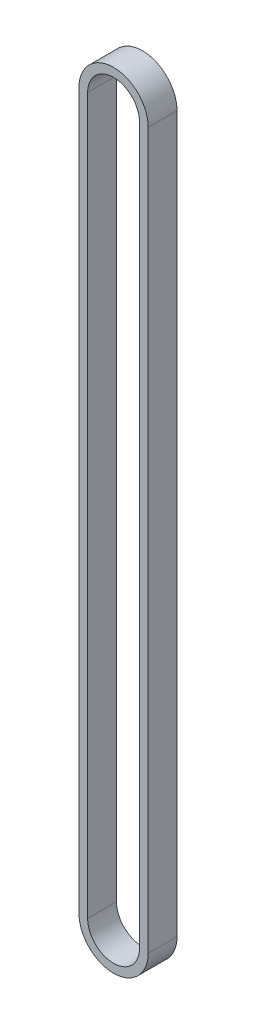
from build123d import *

# Parameters (mm, degrees)
EXTRUDE_1_DEPTH = 10


with BuildPart() as part:
    # 草图1 → 凸台-拉伸1 (new body)
    with BuildSketch(Plane.XY):
        with BuildLine():
            ThreePointArc((-12, 248), (-11.22497216, 243.757359313), (-9, 240.062746067))
            Line((-9, 240.062746067), (-9, 248))
            ThreePointArc((-9, 248), (0, 257), (9, 248))
            Line((9, 248), (9, 240.062746067))
            ThreePointArc((9, 240.062746067), (11.22497216, 243.757359313), (12, 248))
            ThreePointArc((12, 248), (0, 260), (-12, 248))
        make_face()
        with BuildLine():
            ThreePointArc((-12, 0), (-11.22497216, 4.242640687), (-9, 7.937253933))
            Line((-9, 7.937253933), (-9, 240.062746067))
            ThreePointArc((-9, 240.062746067), (-11.22497216, 243.757359313), (-12, 248))
            Line((-12, 248), (-12, 0))
        make_face()
        with BuildLine():
            Line((9, 240.062746067), (9, 7.937253933))
            ThreePointArc((9, 7.937253933), (11.22497216, 4.242640687), (12, 0))
            Line((12, 0), (12, 248))
            ThreePointArc((12, 248), (11.22497216, 243.757359313), (9, 240.062746067))
        make_face()
        with BuildLine():
            Line((9, 7.937253933), (9, 0))
            ThreePointArc((9, 0), (0, -9), (-9, 0))
            Line((-9, 0), (-9, 7.937253933))
            ThreePointArc((-9, 7.937253933), (-11.22497216, 4.242640687), (-12, 0))
            ThreePointArc((-12, 0), (0, -12), (12, 0))
            ThreePointArc((12, 0), (11.22497216, 4.242640687), (9, 7.937253933))
        make_face()
    extrude(amount=EXTRUDE_1_DEPTH)


solid = part.part
